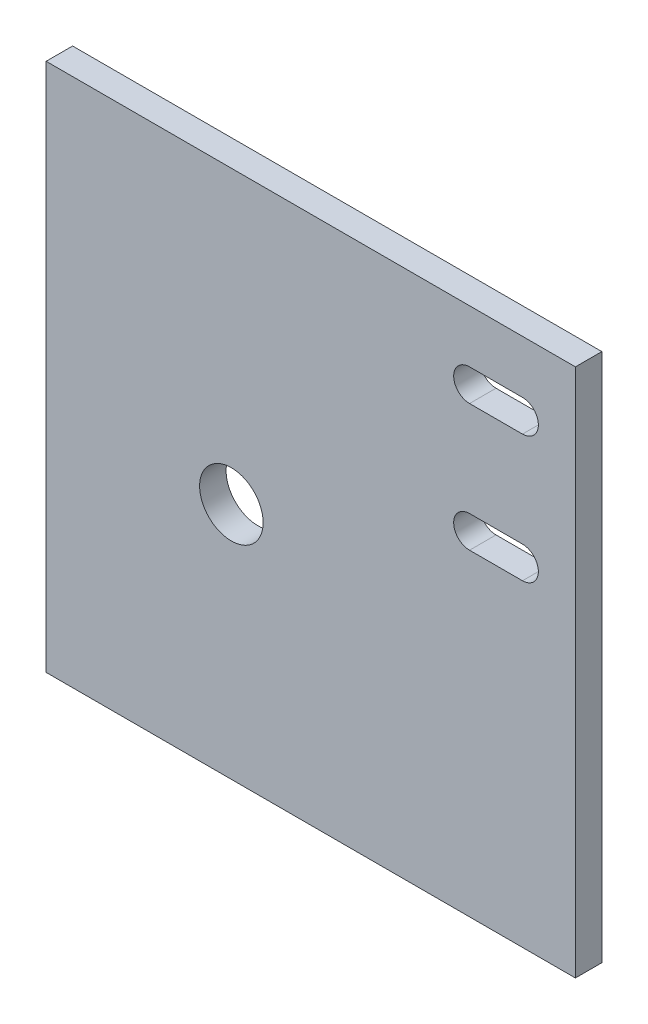
from build123d import *

# Parameters (mm, degrees)
ESQUISSE1_W             = 100
ESQUISSE1_H             = 100
BOSS_EXTRU_1_DEPTH      = 5
ESQUISSE2_R             = 6
ENL_V_MAT_EXTRU_1_DEPTH = 5


with BuildPart() as part:
    # Esquisse1 → Boss.-Extru.1 (new body)
    with BuildSketch(Plane.XY):
        with Locations((50, -50)):
            Rectangle(ESQUISSE1_W, ESQUISSE1_H)
        with BuildLine():
            Line((80, -10), (90, -10))
            ThreePointArc((90, -10), (93, -13), (90, -16))
            Line((90, -16), (80, -16))
            ThreePointArc((80, -16), (77, -13), (80, -10))
        make_face(mode=Mode.SUBTRACT)
        with BuildLine():
            Line((80, -34), (90, -34))
            ThreePointArc((90, -34), (93, -37), (90, -40))
            Line((90, -40), (80, -40))
            ThreePointArc((80, -40), (77, -37), (80, -34))
        make_face(mode=Mode.SUBTRACT)
    extrude(amount=BOSS_EXTRU_1_DEPTH)

    # Esquisse2 → Enlèv. mat.-Extru.1 (cut)
    with BuildSketch(Plane.XY.offset(5)):
        with Locations((35, -55)):
            Circle(ESQUISSE2_R)
    extrude(amount=-ENL_V_MAT_EXTRU_1_DEPTH, mode=Mode.SUBTRACT)


solid = part.part
